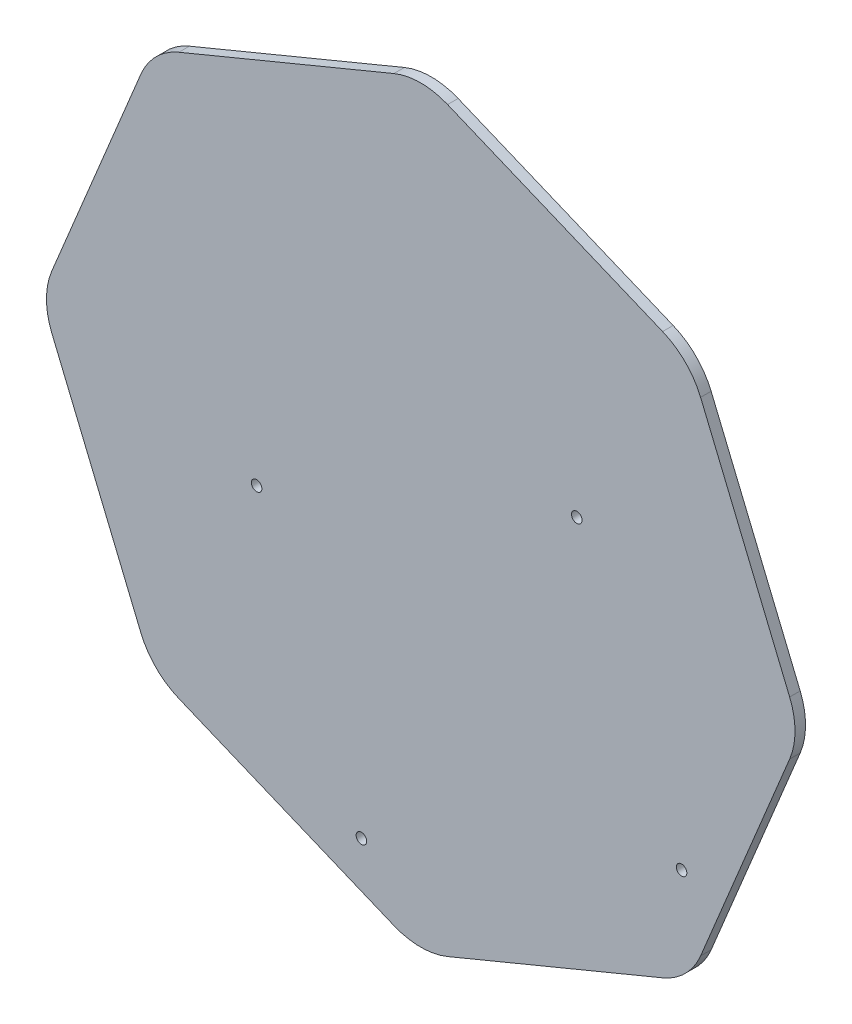
from build123d import *

# Parameters (mm, degrees)
SKETCH_1_R      = 1.5
EXTRUDE_1_DEPTH = 3
FILLET_1_R      = 20


with BuildPart() as part:
    # 草图1 → 凸台-拉伸1 (new body)
    with BuildSketch(Plane.XY):
        Polygon((0, 108.239220029), (-76.536686473, 76.536686473), (-108.239220029, 0), (-76.536686473, -76.536686473), (0, -108.239220029), (76.536686473, -76.536686473), (108.239220029, 0), (76.536686473, 76.536686473), align=None)
        with Locations((-46.741505227, -16.11378879)):
            Circle(SKETCH_1_R, mode=Mode.SUBTRACT)
        with Locations((-16.892197502, -88.176392326)):
            Circle(SKETCH_1_R, mode=Mode.SUBTRACT)
        with Locations((74.294712357, -50.405537551)):
            Circle(SKETCH_1_R, mode=Mode.SUBTRACT)
        with Locations((44.445404632, 21.657065985)):
            Circle(SKETCH_1_R, mode=Mode.SUBTRACT)
    extrude(amount=EXTRUDE_1_DEPTH)

    # 圆角1
    fillet_1_edges = [part.edges().sort_by_distance(p)[0] for p in [
        (76.536686473, 76.536686473, 1.5),
        (108.239220029, 0, 1.5),
        (76.536686473, -76.536686473, 1.5),
        (0, -108.239220029, 1.5),
        (-76.536686473, -76.536686473, 1.5),
        (-108.239220029, 0, 1.5),
        (-76.536686473, 76.536686473, 1.5),
        (0, 108.239220029, 1.5),
    ]]
    fillet(fillet_1_edges, radius=FILLET_1_R)


solid = part.part
